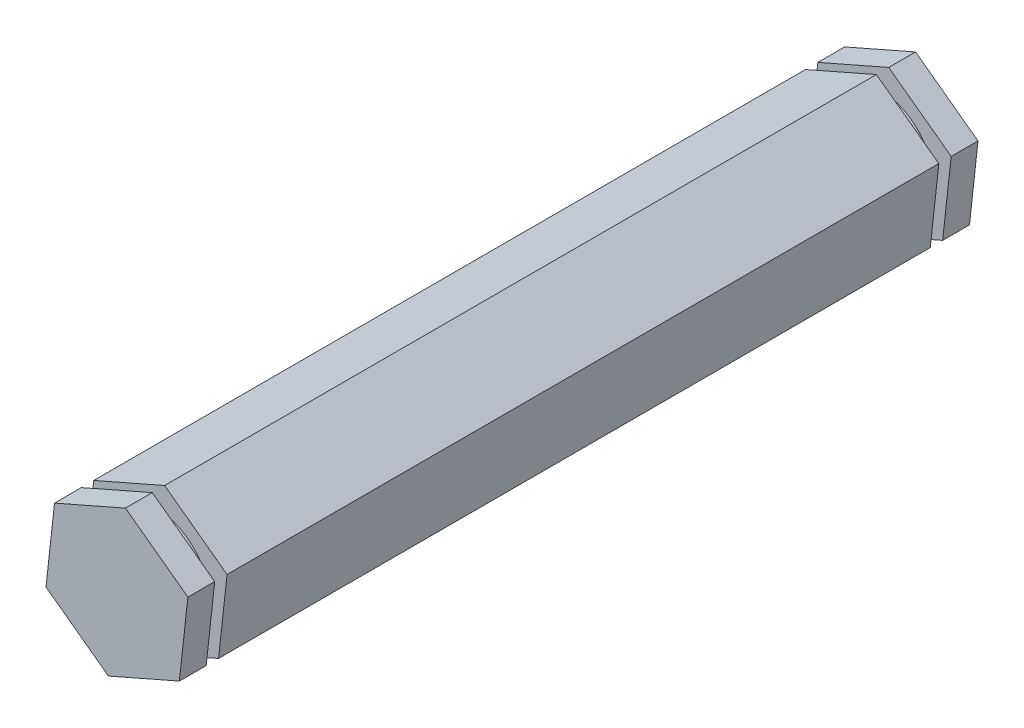
from build123d import *

# Parameters (mm, degrees)
BOSS_EXTRUDE1_DEPTH = 67.3735
SKETCH2_R           = 5.0292
BOSS_EXTRUDE2_DEPTH = 1.1684
BOSS_EXTRUDE3_DEPTH = 2.54
BOSS_EXTRUDE4_START = 1.1684
SKETCH5_R           = 5.0292
BOSS_EXTRUDE4_DEPTH = 1.1684
BOSS_EXTRUDE5_DEPTH = 2.54


with BuildPart() as part:
    # Sketch1 → Boss-Extrude1 (new body)
    with BuildSketch(Plane.XY):
        Polygon((5.908332382, -4.342227746), (6.714645728, 2.945652064), (0.806313346, 7.28787981), (-5.908332382, 4.342227746), (-6.714645728, -2.945652064), (-0.806313346, -7.28787981), align=None)
    extrude(amount=BOSS_EXTRUDE1_DEPTH)

    # Sketch2 → Boss-Extrude2 (add)
    with BuildSketch(Plane.XY.offset(67.3735)):
        Circle(SKETCH2_R)
    extrude(amount=BOSS_EXTRUDE2_DEPTH)

    # Sketch3 → Boss-Extrude3 (add)
    with BuildSketch(Plane.XY.offset(68.5419)):
        Polygon((-0.806313346, -7.28787981), (5.908332382, -4.342227746), (6.714645728, 2.945652064), (0.806313346, 7.28787981), (-5.908332382, 4.342227746), (-6.714645728, -2.945652064), align=None)
    extrude(amount=BOSS_EXTRUDE3_DEPTH)

    # Sketch5 → Boss-Extrude4 (add)
    with BuildSketch(Plane(origin=(0, 0, 0), x_dir=(-1, 0, 0), z_dir=(0, 0, -1)).offset(BOSS_EXTRUDE4_START)):
        with Locations(Location((0, 0, 0), (0, 0, 180))):
            Circle(SKETCH5_R)
    extrude(amount=-BOSS_EXTRUDE4_DEPTH)

    # Sketch6 → Boss-Extrude5 (add)
    with BuildSketch(Plane(origin=(0, 0, -1.1684), x_dir=(-1, 0, 0), z_dir=(0, 0, -1))):
        Polygon((-5.908332382, -4.342227746), (0.806313346, -7.28787981), (6.714645728, -2.945652064), (5.908332382, 4.342227746), (-0.806313346, 7.28787981), (-6.714645728, 2.945652064), align=None)
    extrude(amount=BOSS_EXTRUDE5_DEPTH)


solid = part.part
